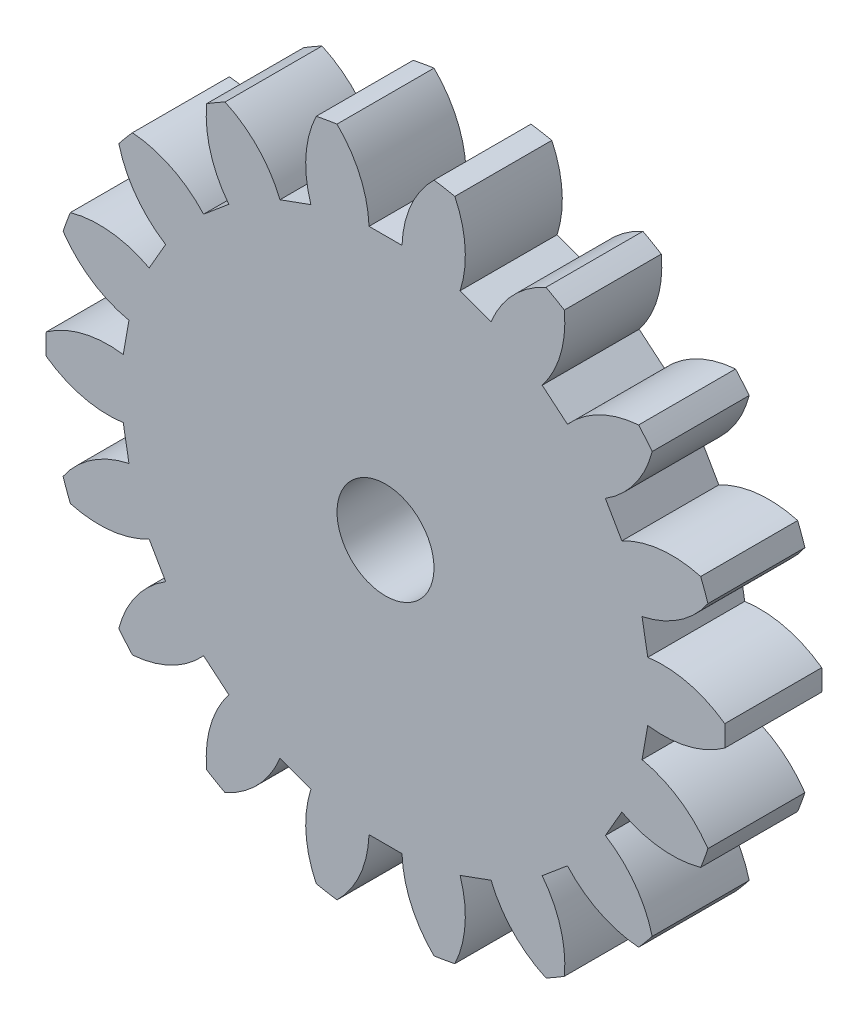
from build123d import *

# Parameters (mm, degrees)
SKETCH1_R           = 35
BOSS_EXTRUDE1_DEPTH = 10
CUT_EXTRUDE1_DEPTH  = 10
CIRPATTERN1_COUNT   = 18
SKETCH3_R           = 5
CUT_EXTRUDE2_DEPTH  = 10


with BuildPart() as part:
    # Sketch1 → Boss-Extrude1 (new body)
    with BuildSketch(Plane.XY):
        Circle(SKETCH1_R)
    extrude(amount=BOSS_EXTRUDE1_DEPTH)

    # Sketch2 → Cut-Extrude1 (cut)
    with BuildSketch(Plane.XY):
        with BuildLine():
            Line((0, 27.161016151), (-1.7, 27.161016151))
            ThreePointArc((-1.7, 27.161016151), (-2.629181754, 31.219024201), (-5, 34.641016151))
            ThreePointArc((-5, 34.641016151), (-2.962634917, 36.808842577), (0, 37.07925382))
            ThreePointArc((0, 37.07925382), (2.962634917, 36.808842577), (5, 34.641016151))
            ThreePointArc((5, 34.641016151), (2.629181754, 31.219024201), (1.7, 27.161016151))
            Line((1.7, 27.161016151), (0, 27.161016151))
        make_face()
    cut_extrude1 = extrude(amount=CUT_EXTRUDE1_DEPTH, mode=Mode.SUBTRACT)

    # CirPattern1: Cut-Extrude1 ×18 about axis
    cirpattern1_axis = Axis((0, 0, 0), (0, 0, 1))
    for i in range(1, CIRPATTERN1_COUNT):
        add(cut_extrude1.rotate(cirpattern1_axis, i * 360 / CIRPATTERN1_COUNT), mode=Mode.SUBTRACT)

    # Sketch3 → Cut-Extrude2 (cut)
    with BuildSketch(Plane.XY):
        Circle(SKETCH3_R)
    extrude(amount=CUT_EXTRUDE2_DEPTH, mode=Mode.SUBTRACT)


solid = part.part
